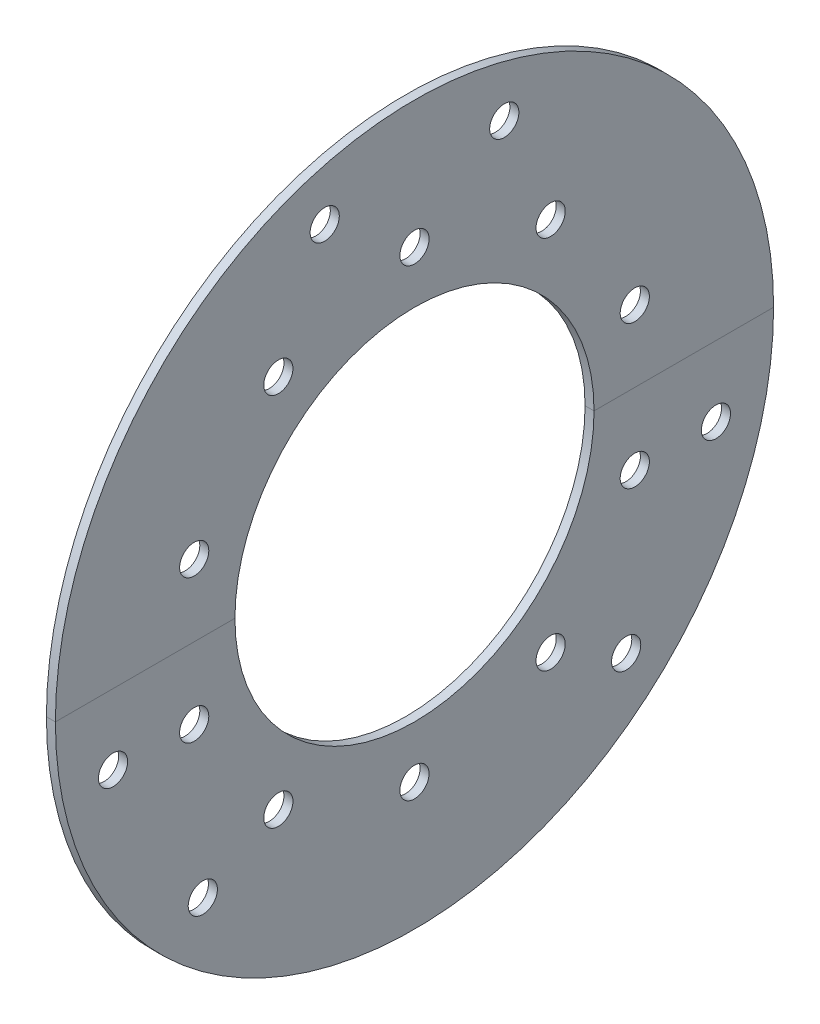
from build123d import *

# Parameters (mm, degrees)
SKETCH1_R           = 80
SKETCH1_R_2         = 40
SKETCH1_R_3         = 3.25
BOSS_EXTRUDE1_DEPTH = 2


with BuildPart() as part:
    # Sketch1 → Boss-Extrude1 (new body)
    with BuildSketch(Plane(origin=(0, 0, 0), x_dir=(0, 0, -1), z_dir=(1, 0, 0))):
        Circle(SKETCH1_R)
        Circle(SKETCH1_R_2, mode=Mode.SUBTRACT)
        with Locations((30.329719018, 41.74527691)):
            Circle(SKETCH1_R_3, mode=Mode.SUBTRACT)
        with Locations((49.074516241, 15.94527691)):
            Circle(SKETCH1_R_3, mode=Mode.SUBTRACT)
        with Locations((49.074516241, -15.94527691)):
            Circle(SKETCH1_R_3, mode=Mode.SUBTRACT)
        with Locations((30.329719018, -41.74527691)):
            Circle(SKETCH1_R_3, mode=Mode.SUBTRACT)
        with Locations((0, -51.6)):
            Circle(SKETCH1_R_3, mode=Mode.SUBTRACT)
        with Locations((-30.329719018, -41.74527691)):
            Circle(SKETCH1_R_3, mode=Mode.SUBTRACT)
        with Locations((-49.074516241, -15.94527691)):
            Circle(SKETCH1_R_3, mode=Mode.SUBTRACT)
        with Locations((-49.074516241, 15.94527691)):
            Circle(SKETCH1_R_3, mode=Mode.SUBTRACT)
        with Locations((-30.329719018, 41.74527691)):
            Circle(SKETCH1_R_3, mode=Mode.SUBTRACT)
        with Locations((0, 51.6)):
            Circle(SKETCH1_R_3, mode=Mode.SUBTRACT)
        with Locations((-20, 66)):
            Circle(SKETCH1_R_3, mode=Mode.SUBTRACT)
        with Locations((20, 66)):
            Circle(SKETCH1_R_3, mode=Mode.SUBTRACT)
        with Locations((67.15767665, -15.679491924)):
            Circle(SKETCH1_R_3, mode=Mode.SUBTRACT)
        with Locations((47.15767665, -50.320508076)):
            Circle(SKETCH1_R_3, mode=Mode.SUBTRACT)
        with Locations((-47.15767665, -50.320508076)):
            Circle(SKETCH1_R_3, mode=Mode.SUBTRACT)
        with Locations((-67.15767665, -15.679491924)):
            Circle(SKETCH1_R_3, mode=Mode.SUBTRACT)
    extrude(amount=BOSS_EXTRUDE1_DEPTH)


with BuildPart() as body_2:
    # Split1: the piece on the far side of the plane
    add(part.part)
    split(bisect_by=Plane.ZX, keep=Keep.BOTTOM)


with BuildPart() as part_1:
    add(part.part)

    # Split1
    split(bisect_by=Plane.ZX, keep=Keep.TOP)


solid = Compound([body_2.part, part_1.part])
